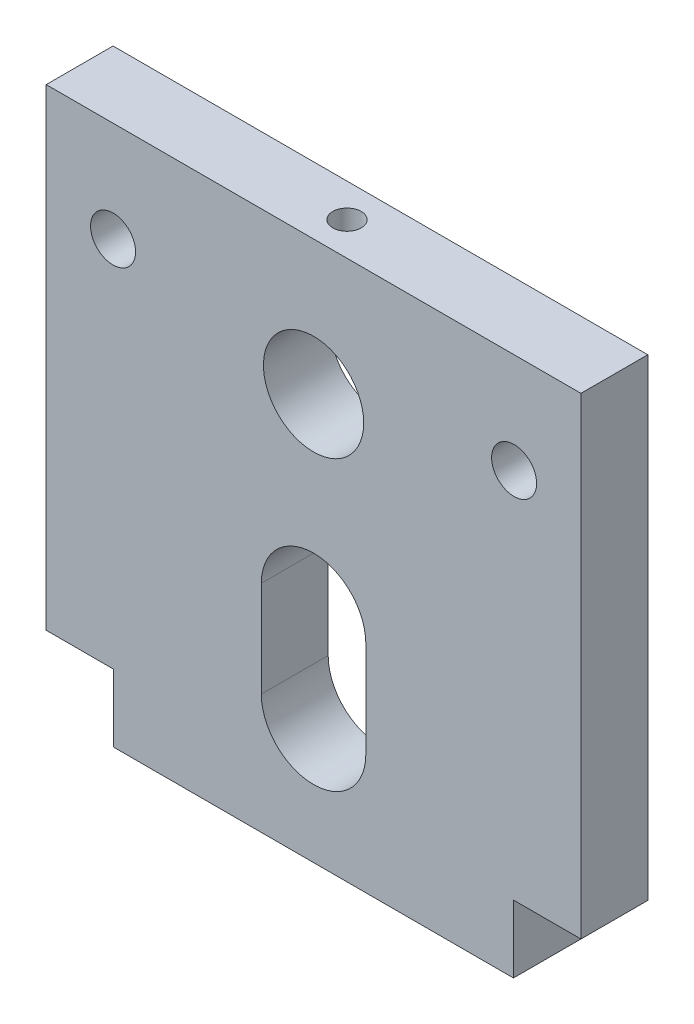
from build123d import *

# Parameters (mm, degrees)
BOSS_EXTRUDE1_DEPTH        = 6.35
SKETCH2_R                  = 4.7625
CUT_EXTRUDE1_DEPTH         = 6.35
SKETCH3_R                  = 2.13995
CUT_EXTRUDE2_DEPTH         = 6.35
CUT_EXTRUDE4_DEPTH         = 6.35
F_6_32_TAPPED_HOLE1_REACH  = 59.727
F_6_32_TAPPED_HOLE1_BORE_R = 1.35255


with BuildPart() as part:
    # Sketch1 → Boss-Extrude1 (new body)
    with BuildSketch(Plane.XY):
        Polygon((-25.683252906, 38.866643011), (25.116747094, 38.866643011), (25.116747094, -6.027856989), (18.703247094, -6.027856989), (18.703247094, -12.441356989), (-19.269752906, -12.441356989), (-19.269752906, -6.027856989), (-25.683252906, -6.027856989), align=None)
    extrude(amount=BOSS_EXTRUDE1_DEPTH)

    # Sketch2 → Cut-Extrude1 (cut)
    with BuildSketch(Plane.XY.offset(6.35)):
        with Locations((-0.283252906, 26.103143011)):
            Circle(SKETCH2_R)
    extrude(amount=-CUT_EXTRUDE1_DEPTH, mode=Mode.SUBTRACT)

    # Sketch3 → Cut-Extrude2 (cut)
    with BuildSketch(Plane.XY.offset(6.35)):
        with Locations((-19.333252906, 29.341643011)):
            Circle(SKETCH3_R)
        with Locations((18.766747094, 29.341643011)):
            Circle(SKETCH3_R)
    extrude(amount=-CUT_EXTRUDE2_DEPTH, mode=Mode.SUBTRACT)

    # Sketch6 → Cut-Extrude4 (cut)
    with BuildSketch(Plane.XY.offset(6.35)):
        with BuildLine():
            Line((4.679797411, 8.060661082), (4.679797411, -1.058338959))
            ThreePointArc((4.679797411, -1.058338959), (-0.283252906, -6.021389275), (-5.246303222, -1.058338959))
            Line((-5.246303222, -1.058338959), (-5.246303222, 8.060661082))
            ThreePointArc((-5.246303222, 8.060661082), (-0.283252906, 13.023711398), (4.679797411, 8.060661082))
        make_face()
    extrude(amount=-CUT_EXTRUDE4_DEPTH, mode=Mode.SUBTRACT)

    # #6-32 Tapped Hole1 bore → #6-32 Tapped Hole1 (cut, up to next)
    with BuildSketch(Plane(origin=(0, 38.866643011, 0), x_dir=(1, 0, 0), z_dir=(0, 1, 0)), mode=Mode.PRIVATE) as f_6_32_tapped_hole1_sk1:
        with Locations((-0.283252906, -3.175)):
            Circle(F_6_32_TAPPED_HOLE1_BORE_R)
    f_6_32_tapped_hole1_tool1 = extrude(f_6_32_tapped_hole1_sk1.sketch, amount=-F_6_32_TAPPED_HOLE1_REACH, mode=Mode.PRIVATE) & part.part
    add(f_6_32_tapped_hole1_tool1.solids().sort_by_distance((-0.283253, 38.866643, 3.175))[0], mode=Mode.SUBTRACT)


solid = part.part
